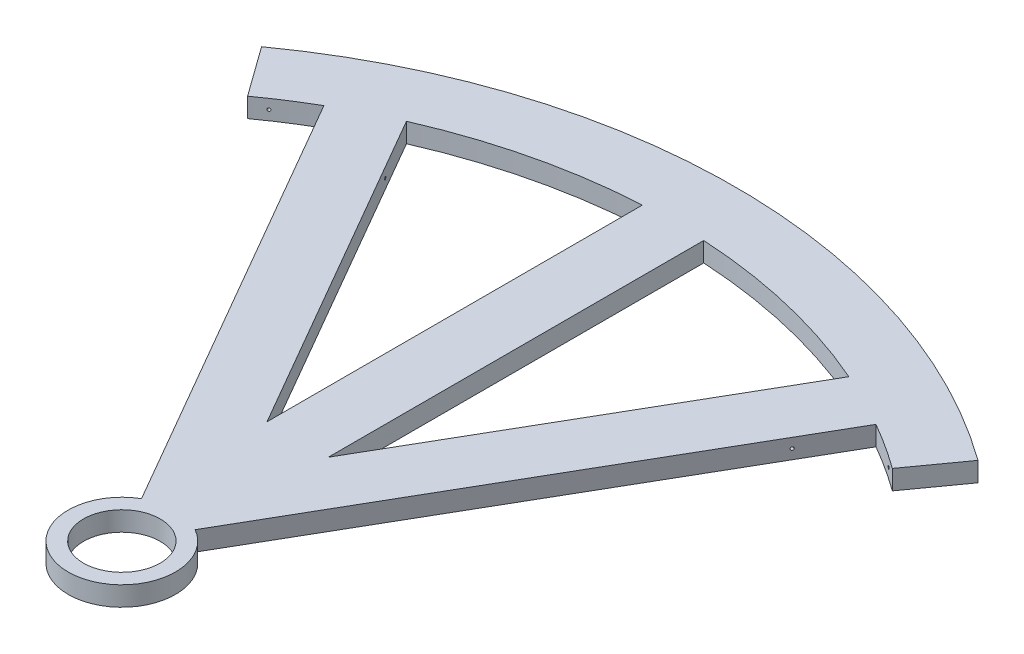
from build123d import *

# Parameters (mm, degrees)
SKETCH1_R           = 12.5
BOSS_EXTRUDE1_DEPTH = 6.35
SKETCH2_R           = 0.5
CUT_EXTRUDE1_DEPTH  = 21
SKETCH4_R           = 0.5
CUT_EXTRUDE2_DEPTH  = 258.99218142


with BuildPart() as part:
    # Sketch1 → Boss-Extrude1 (new body)
    with BuildSketch(Plane(origin=(0, 0, 0), x_dir=(1, 0, 0), z_dir=(0, 1, 0))):
        with BuildLine():
            ThreePointArc((-105.118959503, -27.088673899), (-97.681658234, -22.015485729), (-90, -17.320508076))
            Line((-90, -17.320508076), (-8.75, -158.049636191))
            ThreePointArc((-8.75, -158.049636191), (0, -190.705080757), (8.75, -158.049636191))
            Line((8.75, -158.049636191), (90, -17.320508076))
            ThreePointArc((90, -17.320508076), (97.681658234, -22.015485729), (105.118959503, -27.088673899))
            Line((105.118959503, -27.088673899), (116.798843892, -10.853517582))
            ThreePointArc((116.798843892, -10.853517582), (0, 26.794919243), (-116.798843892, -10.853517582))
            Line((-116.798843892, -10.853517582), (-105.118959503, -27.088673899))
        make_face()
        with Locations(Location((0, -173.205080757, 0), (0, 0, 270))):
            Circle(SKETCH1_R, mode=Mode.SUBTRACT)
        with BuildLine():
            Line((-10, -115.884572681), (-72.122211024, -8.285746909))
            ThreePointArc((-72.122211024, -8.285746909), (-41.722825565, 1.892622903), (-10, 6.516926799))
            Line((-10, 6.516926799), (-10, -115.884572681))
        make_face(mode=Mode.SUBTRACT)
        with BuildLine():
            Line((72.122211024, -8.285746909), (10, -115.884572681))
            Line((10, -115.884572681), (10, 6.516926799))
            ThreePointArc((10, 6.516926799), (41.722825565, 1.892622903), (72.122211024, -8.285746909))
        make_face(mode=Mode.SUBTRACT)
    extrude(amount=BOSS_EXTRUDE1_DEPTH)

    # Sketch2 → Cut-Extrude1 (cut)
    with BuildSketch(Plane(origin=(-75, 0, 43.301270189), x_dir=(0.499999999999998, 0, 0.8660254037844398), z_dir=(-0.8660254037844399, 0, 0.49999999999999806))):
        with Locations((-10, 3.175)):
            Circle(SKETCH2_R)
    cut_extrude1 = extrude(amount=-CUT_EXTRUDE1_DEPTH, mode=Mode.SUBTRACT)

    # Sketch4 → Cut-Extrude2 (cut, through all)
    with BuildSketch(Plane(origin=(-18.609768778, 0, -28.803804686), x_dir=(-0.8399421946003115, 0, 0.5426758790751738), z_dir=(-0.5426758790751737, 0, -0.8399421946003114))):
        with Locations(Location((97.99421946, 3.175, 0), (0, 0, 180))):
            Circle(SKETCH4_R)
    cut_extrude2 = extrude(amount=CUT_EXTRUDE2_DEPTH, mode=Mode.SUBTRACT)

    # Mirror1: Cut-Extrude1, Cut-Extrude2 across plane
    add(cut_extrude1.mirror(Plane(origin=(0, 0, 0), x_dir=(0, 0, 1), z_dir=(1, 0, 0))), mode=Mode.SUBTRACT)
    add(cut_extrude2.mirror(Plane(origin=(0, 0, 0), x_dir=(0, 0, 1), z_dir=(1, 0, 0))), mode=Mode.SUBTRACT)


solid = part.part
